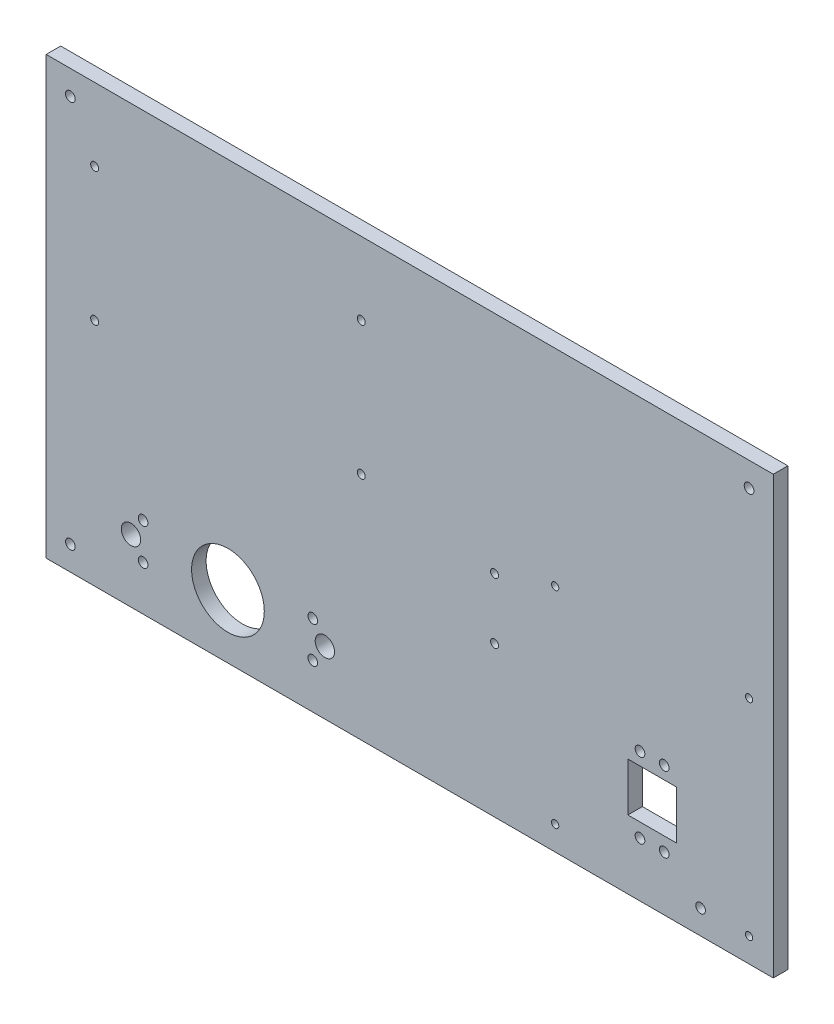
from build123d import *

# Parameters (mm, degrees)
ESBO_O1_W                = 300
ESBO_O1_H                = 180
ESBO_O1_R                = 1.5
ESBO_O1_R_2              = 2
ESBO_O1_R_3              = 15
ESBO_O1_R_4              = 4
ESBO_O1_R_5              = 1.65
ESBO_O1_W_2              = 20
ESBO_O1_H_2              = 20
RESSALTO_EXTRUS_O1_DEPTH = 6
ESBO_O2_R                = 2
CORTE_EXTRUS_O1_DEPTH    = 10
ESBO_O3_R                = 2
CORTE_EXTRUS_O2_DEPTH    = 10


with BuildPart() as part:
    # Esboço1 → Ressalto-extrusão1 (new body)
    with BuildSketch(Plane.XY):
        Rectangle(ESBO_O1_W, ESBO_O1_H)
        with Locations((140, 5)):
            Circle(ESBO_O1_R, mode=Mode.SUBTRACT)
        with Locations((140, -80)):
            Circle(ESBO_O1_R, mode=Mode.SUBTRACT)
        with Locations((60, -80)):
            Circle(ESBO_O1_R, mode=Mode.SUBTRACT)
        with Locations((60, 5)):
            Circle(ESBO_O1_R, mode=Mode.SUBTRACT)
        with Locations((-110, -56.5)):
            Circle(ESBO_O1_R_2, mode=Mode.SUBTRACT)
        with Locations((-40, -56.5)):
            Circle(ESBO_O1_R_2, mode=Mode.SUBTRACT)
        with Locations((-75, -64)):
            Circle(ESBO_O1_R_3, mode=Mode.SUBTRACT)
        with Locations((-35, -64)):
            Circle(ESBO_O1_R_4, mode=Mode.SUBTRACT)
        with Locations((-115, -64)):
            Circle(ESBO_O1_R_4, mode=Mode.SUBTRACT)
        with Locations((-40, -71.5)):
            Circle(ESBO_O1_R_2, mode=Mode.SUBTRACT)
        with Locations((-110, -71.5)):
            Circle(ESBO_O1_R_2, mode=Mode.SUBTRACT)
        with Locations((35, -3)):
            Circle(ESBO_O1_R_5, mode=Mode.SUBTRACT)
        with Locations((35, -28)):
            Circle(ESBO_O1_R_5, mode=Mode.SUBTRACT)
        with Locations((-130, 60)):
            Circle(ESBO_O1_R_5, mode=Mode.SUBTRACT)
        with Locations((-20, 60)):
            Circle(ESBO_O1_R_5, mode=Mode.SUBTRACT)
        with Locations((-20, 5)):
            Circle(ESBO_O1_R_5, mode=Mode.SUBTRACT)
        with Locations((-130, 5)):
            Circle(ESBO_O1_R_5, mode=Mode.SUBTRACT)
        with Locations((100, -51.75)):
            Rectangle(ESBO_O1_W_2, ESBO_O1_H_2, mode=Mode.SUBTRACT)
    extrude(amount=RESSALTO_EXTRUS_O1_DEPTH)

    # Esboço2 → Corte-extrusão1 (cut)
    with BuildSketch(Plane.XY.offset(6)):
        with Locations((-140, 80)):
            Circle(ESBO_O2_R)
        with Locations((140, 80)):
            Circle(ESBO_O2_R)
        with Locations((120, -80)):
            Circle(ESBO_O2_R)
        with Locations((-140, -80)):
            Circle(ESBO_O2_R)
    extrude(amount=-CORTE_EXTRUS_O1_DEPTH, mode=Mode.SUBTRACT)

    # Esboço3 → Corte-extrusão2 (cut)
    with BuildSketch(Plane.XY.offset(6)):
        with Locations((105, -67.5)):
            Circle(ESBO_O3_R)
        with Locations((105, -36.5)):
            Circle(ESBO_O3_R)
        with Locations((95, -36.5)):
            Circle(ESBO_O3_R)
        with Locations((95, -67.5)):
            Circle(ESBO_O3_R)
    extrude(amount=-CORTE_EXTRUS_O2_DEPTH, mode=Mode.SUBTRACT)


solid = part.part
